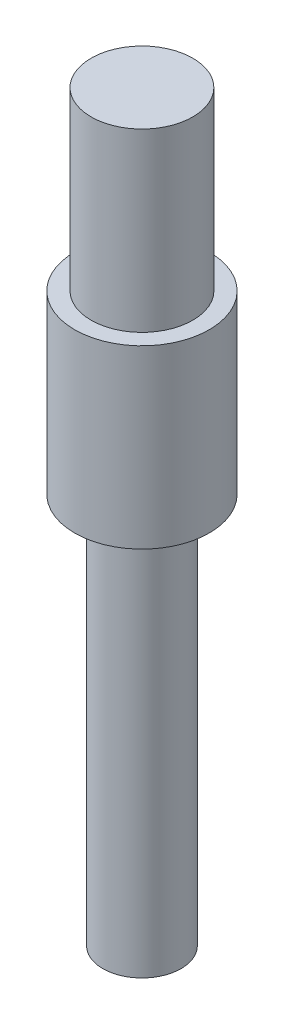
from build123d import *

# Parameters (mm, degrees)
SKETCH1_R           = 6.35
BOSS_EXTRUDE1_DEPTH = 63.5
SKETCH2_R           = 10.922
BOSS_EXTRUDE2_DEPTH = 28.575
SKETCH3_R           = 8.255
BOSS_EXTRUDE3_DEPTH = 28.575


with BuildPart() as part:
    # Sketch1 → Boss-Extrude1 (new body)
    with BuildSketch(Plane(origin=(0, 0, 0), x_dir=(1, 0, 0), z_dir=(0, 1, 0))):
        with Locations(Location((0, 0, 0), (0, 0, 270))):
            Circle(SKETCH1_R)
    extrude(amount=BOSS_EXTRUDE1_DEPTH)

    # Sketch2 → Boss-Extrude2 (add)
    with BuildSketch(Plane(origin=(0, 63.5, 0), x_dir=(1, 0, 0), z_dir=(0, 1, 0))):
        with Locations(Location((0, 0, 0), (0, 0, 270))):
            Circle(SKETCH2_R)
    extrude(amount=BOSS_EXTRUDE2_DEPTH)

    # Sketch3 → Boss-Extrude3 (add)
    with BuildSketch(Plane(origin=(0, 92.075, 0), x_dir=(1, 0, 0), z_dir=(0, 1, 0))):
        with Locations(Location((0, 0, 0), (0, 0, 270))):
            Circle(SKETCH3_R)
    extrude(amount=BOSS_EXTRUDE3_DEPTH)


solid = part.part
